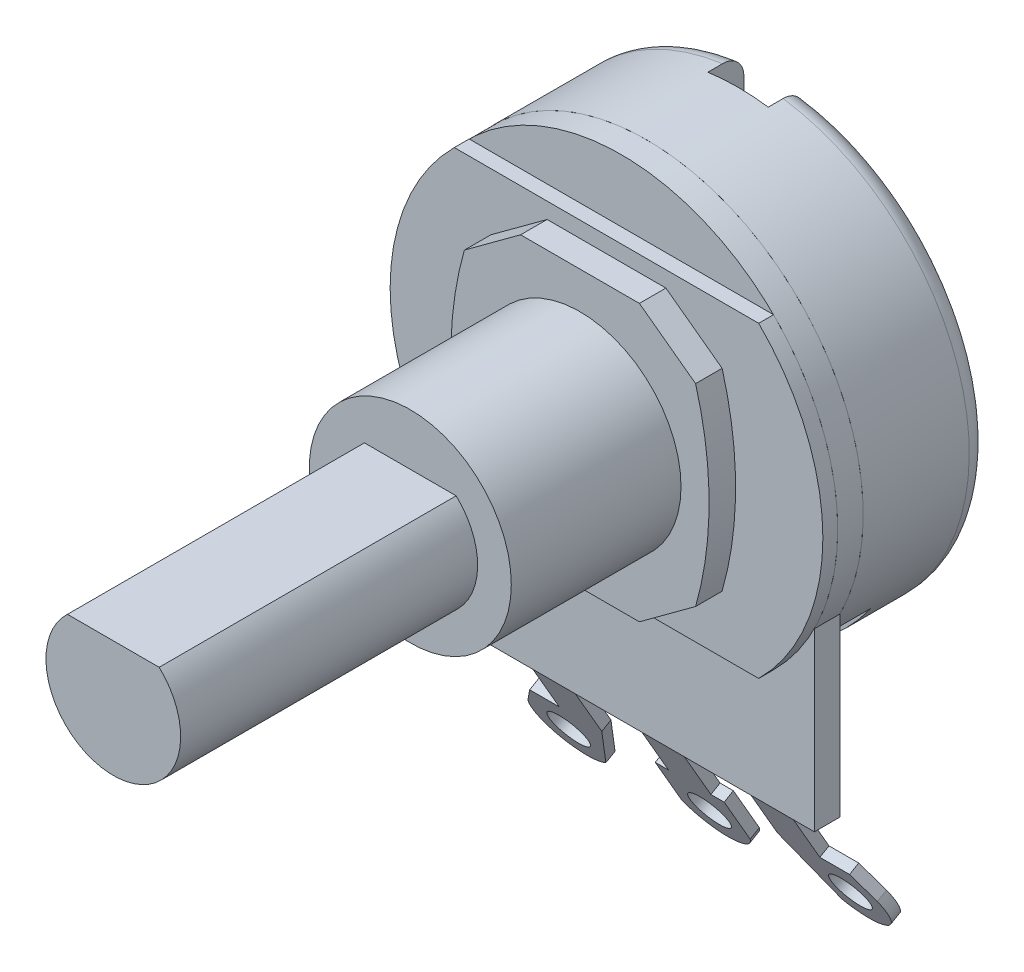
from build123d import *

# Parameters (mm, degrees)
SKETCH1_R             = 4.7625
THREAD_DEPTH          = 8
D_DRIVE_DEPTH         = 14
BACK_PLATE_1_DEPTH    = 1.25
BACK_PLATE_2_DEPTH    = 0.7
CARDBOARD_PLATE_DEPTH = 1.2
SKETCH6_R             = 10.2
SKETCH6_R_2           = 3
MAIN_CASE_DEPTH       = 6
FILLET1_R             = 1
SKETCH7_R             = 3
DRIVE_DEPTH           = 7.2
FILLET2_R             = 0.5
SKETCH8_W             = 4.15
SKETCH8_H             = 1.1
CUT_EXTRUDE1_DEPTH    = 1.75
SHELL1_T              = -0.75
CUT_EXTRUDE2_START    = -1.7
CUT_EXTRUDE2_DEPTH    = 1.7
EXTRUDE8_START        = -0.75
EXTRUDE8_DEPTH        = 0.75
SKETCH12_W            = 2.85
SKETCH12_H            = 0.75
EXTRUDE11_DEPTH       = 0.95
SKETCH13_W            = 4
SKETCH13_H            = 5
EXTRUDE12_DEPTH       = 0.5
EXTRUDE12_2_DEPTH     = 0.5
EXTRUDE12_3_DEPTH     = 0.5
CUT_EXTRUDE3_DEPTH    = 2.2
SKETCH15_R            = 0.925
TAGS_DEPTH            = 0.5
TAGS_2_DEPTH          = 0.5
TAGS_3_DEPTH          = 0.5
FILLET_1_DEPTH        = 2
FILLET_2_DEPTH        = 2
FILLET_3_DEPTH        = 2


with BuildPart() as part:
    # Sketch1 → Thread (new body)
    with BuildSketch(Plane.XY):
        Circle(SKETCH1_R)
    extrude(amount=THREAD_DEPTH)

    # Sketch2 → D Drive (add)
    with BuildSketch(Plane.XY.offset(8)):
        with BuildLine():
            Line((-2.162174831, 2.325), (2.162174831, 2.325))
            ThreePointArc((2.162174831, 2.325), (0, -3.175), (-2.162174831, 2.325))
        make_face()
    extrude(amount=D_DRIVE_DEPTH)

    # Sketch3 → Back Plate 1 (add)
    with BuildSketch(Plane(origin=(0, 0, 0), x_dir=(-1, 0, 0), z_dir=(0, 0, -1))):
        with BuildLine():
            Line((-2.8, 6.5), (2.8, 6.5))
            Line((2.8, 6.5), (5.45, 4.55))
            ThreePointArc((5.45, 4.55), (6.086289369, 0), (5.45, -4.55))
            Line((5.45, -4.55), (2.8, -6.5))
            Line((2.8, -6.5), (-2.8, -6.5))
            Line((-2.8, -6.5), (-5.45, -4.55))
            ThreePointArc((-5.45, -4.55), (-6.086289369, 0), (-5.45, 4.55))
            Line((-5.45, 4.55), (-2.8, 6.5))
        make_face()
    extrude(amount=BACK_PLATE_1_DEPTH)

    # Sketch4 → Back Plate 2 (add)
    with BuildSketch(Plane(origin=(0, 0, -1.25), x_dir=(-1, 0, 0), z_dir=(0, 0, -1))):
        with BuildLine():
            Line((-7.174782227, 7.25), (7.174782227, 7.25))
            ThreePointArc((7.174782227, 7.25), (10.2, 0), (7.174782227, -7.25))
            Line((7.174782227, -7.25), (-7.174782227, -7.25))
            ThreePointArc((-7.174782227, -7.25), (-10.2, 0), (-7.174782227, 7.25))
        make_face()
    extrude(amount=BACK_PLATE_2_DEPTH)


with BuildPart() as body_2:
    # Sketch5 → Cardboard Plate (new body)
    with BuildSketch(Plane(origin=(0, 0, -1.95), x_dir=(-1, 0, 0), z_dir=(0, 0, -1))):
        with BuildLine():
            Line((-9.1, -12.9), (9.1, -12.9))
            Line((9.1, -12.9), (9.1, -4.607602413))
            ThreePointArc((9.1, -4.607602413), (0, 10.2), (-9.1, -4.607602413))
            Line((-9.1, -4.607602413), (-9.1, -12.9))
        make_face()
    extrude(amount=CARDBOARD_PLATE_DEPTH)


with BuildPart() as body_3:
    # Sketch6 → Main Case (new body)
    with BuildSketch(Plane(origin=(0, 0, -3.15), x_dir=(-1, 0, 0), z_dir=(0, 0, -1))):
        Circle(SKETCH6_R)
        Circle(SKETCH6_R_2, mode=Mode.SUBTRACT)
    extrude(amount=MAIN_CASE_DEPTH)

    # Fillet1
    fillet1_edges = [body_3.edges().sort_by_distance(p)[0] for p in [
        (10.2, 0, -9.15),
    ]]
    fillet(fillet1_edges, radius=FILLET1_R)

    # Shell1
    shell1_openings = [body_3.faces().sort_by_distance(p)[0] for p in [
        (9.911500433, 0, -3.15),
    ]]
    offset(amount=SHELL1_T, openings=shell1_openings, kind=Kind.INTERSECTION)

    # Sketch9 → Cut-Extrude2 (cut)
    with BuildSketch(Plane(origin=(0, 0, -9.15), x_dir=(-1, 0, 0), z_dir=(0, 0, -1)).offset(CUT_EXTRUDE2_START)):
        with BuildLine():
            Line((-1.425, 8), (1.425, 8))
            Line((1.425, 8), (1.425, 10.099969059))
            ThreePointArc((1.425, 10.099969059), (0, 10.2), (-1.425, 10.099969059))
            Line((-1.425, 10.099969059), (-1.425, 8))
        make_face()
    extrude(amount=CUT_EXTRUDE2_DEPTH, mode=Mode.SUBTRACT)

    # Sketch10 → Extrude8 (add)
    with BuildSketch(Plane(origin=(0, 0, -7.45), x_dir=(-1, 0, 0), z_dir=(0, 0, -1)).offset(EXTRUDE8_START)):
        with BuildLine():
            Line((-1.425, 7.25), (-1.425, 10.099969059))
            ThreePointArc((-1.425, 10.099969059), (0, 10.2), (1.425, 10.099969059))
            Line((1.425, 10.099969059), (1.425, 7.25))
            Line((1.425, 7.25), (-1.425, 7.25))
        make_face()
    extrude(amount=EXTRUDE8_DEPTH)

    # Sketch12 → Extrude11 (add)
    with BuildSketch(Plane(origin=(0, 0, -7.45), x_dir=(-1, 0, 0), z_dir=(0, 0, -1))):
        with Locations((0, 7.625)):
            Rectangle(SKETCH12_W, SKETCH12_H)
    extrude(amount=EXTRUDE11_DEPTH)

    # Sketch14 → Cut-Extrude3 (cut)
    with BuildSketch(Plane(origin=(0, 0, -3.15), x_dir=(-1, 0, 0), z_dir=(0, 0, -1))):
        with BuildLine():
            Line((8.350358912, -5.857602413), (-8.350358912, -5.857602413))
            ThreePointArc((-8.350358912, -5.857602413), (0, -10.2), (8.350358912, -5.857602413))
        make_face()
    extrude(amount=CUT_EXTRUDE3_DEPTH, mode=Mode.SUBTRACT)


with BuildPart() as body_4:
    # Sketch7 → Drive (new body)
    with BuildSketch(Plane(origin=(0, 0, -3.15), x_dir=(-1, 0, 0), z_dir=(0, 0, -1))):
        Circle(SKETCH7_R)
    extrude(amount=DRIVE_DEPTH)

    # Fillet2
    fillet2_edges = [body_4.edges().sort_by_distance(p)[0] for p in [
        (3, 0, -10.35),
    ]]
    fillet(fillet2_edges, radius=FILLET2_R)

    # Sketch8 → Cut-Extrude1 (cut)
    with BuildSketch(Plane(origin=(0, 0, -10.35), x_dir=(-1, 0, 0), z_dir=(0, 0, -1))):
        Rectangle(SKETCH8_W, SKETCH8_H)
    extrude(amount=-CUT_EXTRUDE1_DEPTH, mode=Mode.SUBTRACT)


with BuildPart() as body_5:
    # Sketch13 → Extrude12 (new body)
    with BuildSketch(Plane(origin=(0, 0, -3.15), x_dir=(-1, 0, 0), z_dir=(0, 0, -1))):
        with Locations((-5.14, -10.9)):
            Rectangle(SKETCH13_W, SKETCH13_H)
    extrude(amount=EXTRUDE12_DEPTH)



with BuildPart() as body_6:
    # Sketch13 → Extrude12 2 (new body)
    with BuildSketch(Plane(origin=(0, 0, -3.15), x_dir=(-1, 0, 0), z_dir=(0, 0, -1))):
        with Locations((0, -10.9)):
            Rectangle(SKETCH13_W, SKETCH13_H)
    extrude(amount=EXTRUDE12_2_DEPTH)



with BuildPart() as body_7:
    # Sketch13 → Extrude12 3 (new body)
    with BuildSketch(Plane(origin=(0, 0, -3.15), x_dir=(-1, 0, 0), z_dir=(0, 0, -1))):
        with Locations((5.14, -10.9)):
            Rectangle(SKETCH13_W, SKETCH13_H)
    extrude(amount=EXTRUDE12_3_DEPTH)



with BuildPart() as body_8:
    # Sketch15 → Tags (new body)
    with BuildSketch(Plane(origin=(0, -1.769503638, 3.064870205), x_dir=(1, 0, 0), z_dir=(0, -0.49999999999999495, 0.8660254037844416))):
        with BuildLine():
            Line((6.14, -13.429740411), (4.14, -13.429740411))
            Line((4.14, -13.429740411), (4.14, -17.329740411))
            Line((4.14, -17.329740411), (5.562094819, -20.559752235))
            ThreePointArc((5.562094819, -20.559752235), (7.674289992, -20.594451015), (8.236241451, -18.558085868))
            Line((8.236241451, -18.558085868), (8.022566844, -18.181109989))
            Line((8.022566844, -18.181109989), (7.54, -17.329740411))
            Line((7.54, -17.329740411), (6.14, -17.329740411))
            Line((6.14, -17.329740411), (6.14, -13.429740411))
        make_face()
        with Locations(Location((6.640593845, -19.213474087, 0), (0, 0, 270))):
            Circle(SKETCH15_R, mode=Mode.SUBTRACT)
    extrude(amount=TAGS_DEPTH)


with BuildPart() as body_9:
    # Sketch15 → Tags 2 (new body)
    with BuildSketch(Plane(origin=(0, -1.769503638, 3.064870205), x_dir=(1, 0, 0), z_dir=(0, -0.49999999999999495, 0.8660254037844416))):
        with BuildLine():
            ThreePointArc((1.625, -19.792265932), (0, -20.938474087), (-1.625, -19.792265932))
            Line((-1.625, -19.792265932), (-1.625, -17.338432173))
            Line((-1.625, -17.338432173), (-1, -17.338432173))
            Line((-1, -17.338432173), (-1, -13.429740411))
            Line((-1, -13.429740411), (1, -13.429740411))
            Line((1, -13.429740411), (1, -17.338432173))
            Line((1, -17.338432173), (1.625, -17.338432173))
            Line((1.625, -17.338432173), (1.625, -19.792265932))
        make_face()
        with Locations(Location((0, -19.213474087, 0), (0, 0, 270))):
            Circle(SKETCH15_R, mode=Mode.SUBTRACT)
    extrude(amount=TAGS_2_DEPTH)


with BuildPart() as body_10:
    # Sketch15 → Tags 3 (new body)
    with BuildSketch(Plane(origin=(0, -1.769503638, 3.064870205), x_dir=(1, 0, 0), z_dir=(0, -0.49999999999999495, 0.8660254037844416))):
        with BuildLine():
            Line((-6.14, -17.329740411), (-7.54, -17.329740411))
            Line((-7.54, -17.329740411), (-8.022566844, -18.181109989))
            Line((-8.022566844, -18.181109989), (-8.236241451, -18.558085868))
            ThreePointArc((-8.236241451, -18.558085868), (-7.674289992, -20.594451015), (-5.562094819, -20.559752235))
            Line((-5.562094819, -20.559752235), (-4.14, -17.329740411))
            Line((-4.14, -17.329740411), (-4.14, -13.429740411))
            Line((-4.14, -13.429740411), (-6.14, -13.429740411))
            Line((-6.14, -13.429740411), (-6.14, -17.329740411))
        make_face()
        with Locations(Location((-6.640593845, -19.213474087, 0), (0, 0, 270))):
            Circle(SKETCH15_R, mode=Mode.SUBTRACT)
    extrude(amount=TAGS_3_DEPTH)


with BuildPart() as body_5_1:
    add(body_5.part)

    add(body_8.part)  # Fillet 1 merges body 8
    # Sketch23 → Fillet 1 (add)
    with BuildSketch(Plane(origin=(6.14, 0, 0), x_dir=(0, 0, -1), z_dir=(1, 0, 0))):
        with BuildLine():
            Line((3.216987298, -13.65), (3.65, -13.4))
            Line((3.65, -13.4), (3.15, -13.4))
            ThreePointArc((3.15, -13.4), (3.167037087, -13.529409523), (3.216987298, -13.65))
        make_face()
    extrude(amount=-FILLET_1_DEPTH)


with BuildPart() as body_6_1:
    add(body_6.part)

    add(body_9.part)  # Fillet 2 merges body 9
    # Sketch24 → Fillet 2 (add)
    with BuildSketch(Plane(origin=(1, 0, 0), x_dir=(0, 0, -1), z_dir=(1, 0, 0))):
        with BuildLine():
            Line((3.216987298, -13.65), (3.65, -13.4))
            Line((3.65, -13.4), (3.15, -13.4))
            ThreePointArc((3.15, -13.4), (3.167037087, -13.529409523), (3.216987298, -13.65))
        make_face()
    extrude(amount=-FILLET_2_DEPTH)


with BuildPart() as body_7_1:
    add(body_7.part)

    add(body_10.part)  # Fillet 3 merges body 10
    # Sketch25 → Fillet 3 (add)
    with BuildSketch(Plane(origin=(-4.14, 0, 0), x_dir=(0, 0, -1), z_dir=(1, 0, 0))):
        with BuildLine():
            Line((3.216987298, -13.65), (3.65, -13.4))
            Line((3.65, -13.4), (3.15, -13.4))
            ThreePointArc((3.15, -13.4), (3.167037087, -13.529409523), (3.216987298, -13.65))
        make_face()
    extrude(amount=-FILLET_3_DEPTH)


solid = Compound([part.part, body_2.part, body_3.part, body_4.part, body_5_1.part, body_6_1.part, body_7_1.part])
